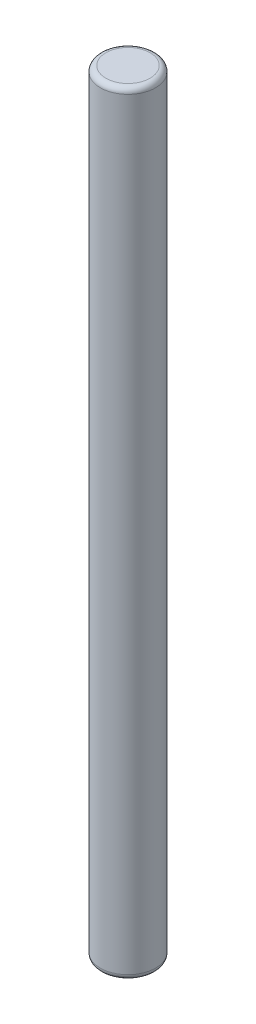
from build123d import *

# Parameters (mm, degrees)
SKETCH_2_R      = 2.5
EXTRUDE_1_DEPTH = 70
FILLET_4_R      = 0.5
FILLET_5_R      = 0.5


with BuildPart() as part:
    # 草图2 → 凸台-拉伸1 (new body)
    with BuildSketch(Plane(origin=(0, 0, 0), x_dir=(1, 0, 0), z_dir=(0, 1, 0))):
        with Locations(Location((0, 0, 0), (0, 0, 270))):
            Circle(SKETCH_2_R)
    extrude(amount=EXTRUDE_1_DEPTH)

    # 圆角4
    fillet_4_edges = [part.edges().sort_by_distance(p)[0] for p in [
        (0, 0, -2.5),
    ]]
    fillet(fillet_4_edges, radius=FILLET_4_R)

    # 圆角5
    fillet_5_edges = [part.edges().sort_by_distance(p)[0] for p in [
        (0, 70, -2.5),
    ]]
    fillet(fillet_5_edges, radius=FILLET_5_R)


solid = part.part
